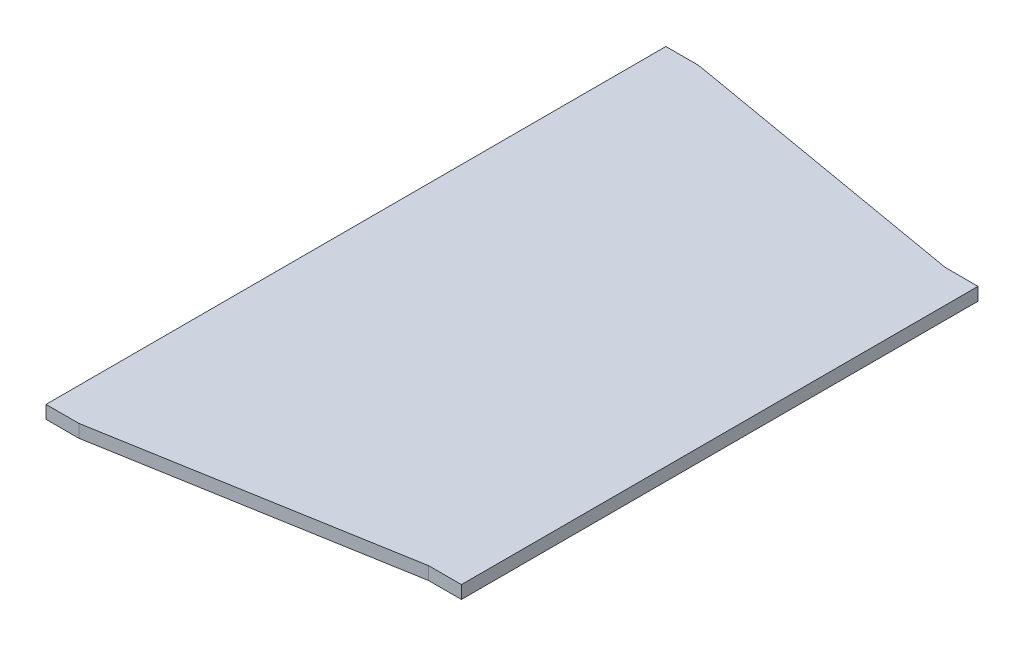
from build123d import *

# Parameters (mm, degrees)
BOSS_EXTRUDE1_DEPTH = 10


with BuildPart() as part:
    # Sketch1 → Boss-Extrude1 (new body)
    with BuildSketch(Plane(origin=(0, 0, 0), x_dir=(1, 0, 0), z_dir=(0, 1, 0))):
        Polygon((230.87, 200), (256.27, 200), (256.27, -200), (230.87, -200), (0, -240), (-25.4, -240), (-25.4, 240), (0, 240), align=None)
    extrude(amount=BOSS_EXTRUDE1_DEPTH)


solid = part.part
